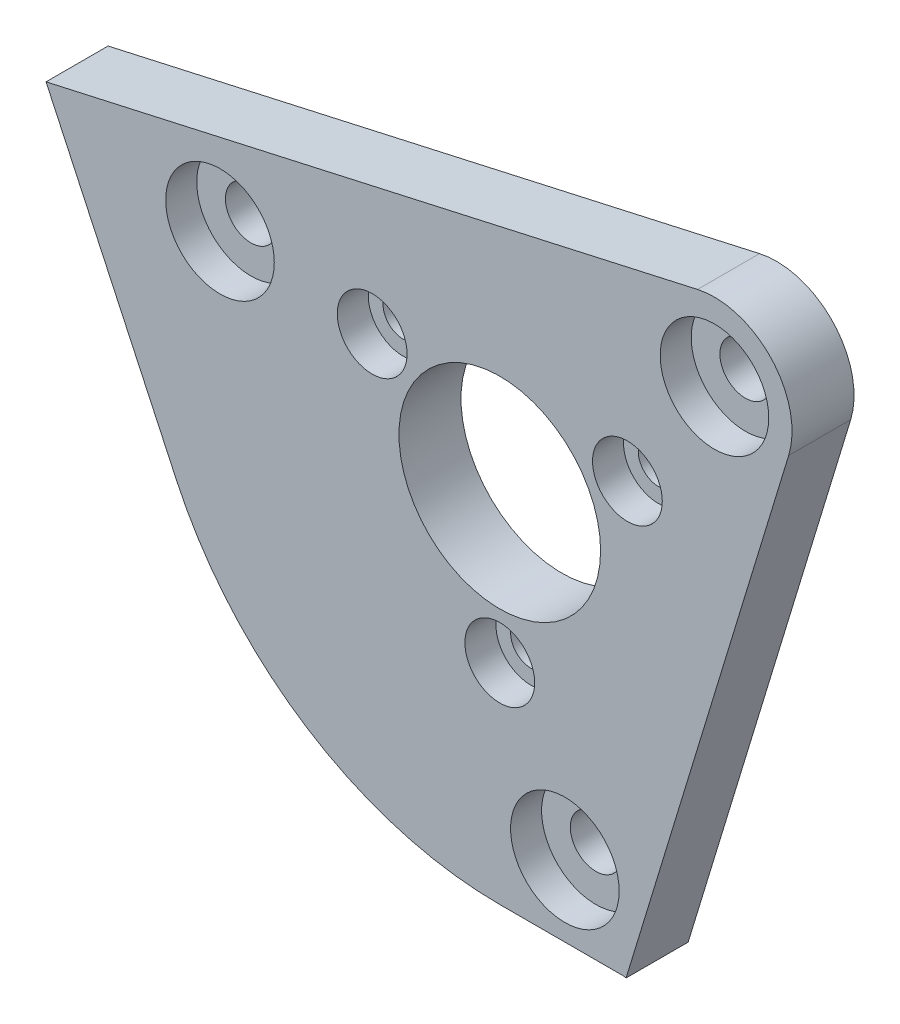
from build123d import *

# Parameters (mm, degrees)
SKETCH_1_R          = 1.3
SKETCH_1_R_2        = 6.5
EXTRUDE_1_DEPTH     = 4
CUT_EXTRUDE_1_DEPTH = 2
CUT_EXTRUDE_2_DEPTH = 10
EXTRUDE_START       = -4
EXTRUDE_2_DEPTH     = 4
FILLET_1_R          = 5
SKETCH_5_R          = 1.65
CUT_EXTRUDE_3_DEPTH = 10
SKETCH_6_R          = 3.5
SKETCH_6_R_2        = 2.25
CUT_EXTRUDE_4_DEPTH = 2


with BuildPart() as part:
    # 草图1 → 凸台-拉伸1 (new body)
    with BuildSketch(Plane.XY):
        with BuildLine():
            Line((8.553461717, -18.071837398), (16.553461717, -18.071837398))
            Line((16.553461717, -18.071837398), (22.424329469, 1.203351624))
            ThreePointArc((22.424329469, 1.203351624), (19.185042818, 15.288156683), (5.383718421, 19.577463907))
            Line((5.383718421, 19.577463907), (-21.197136513, 13.622789192))
            Line((-21.197136513, 13.622789192), (-12.744771278, -4.503366549))
            ThreePointArc((-12.744771278, -4.503366549), (-4.073079079, -14.391536375), (8.553461717, -18.071837398))
        make_face()
        with Locations((16.780703053, 10.178162602)):
            Circle(SKETCH_1_R, mode=Mode.SUBTRACT)
        with Locations((8.553461717, -4.071837398)):
            Circle(SKETCH_1_R, mode=Mode.SUBTRACT)
        with Locations((8.553461717, 5.428162602)):
            Circle(SKETCH_1_R_2, mode=Mode.SUBTRACT)
        with Locations((0.326220381, 10.178162602)):
            Circle(SKETCH_1_R, mode=Mode.SUBTRACT)
    extrude(amount=EXTRUDE_1_DEPTH)

    # 草图2 → 切除-拉伸1 (cut)
    with BuildSketch(Plane.XY.offset(4)):
        with BuildLine():
            Line((-20.74398262, 13.834098323), (-26.791770356, 13.834098323))
            Line((-26.791770356, 13.834098323), (-7.810487919, -16.678792008))
            Line((-7.810487919, -16.678792008), (17.290442954, -20.516537637))
            Line((17.290442954, -20.516537637), (21.405478984, -18.597664823))
            Line((21.405478984, -18.597664823), (16.553461717, -17.571837398))
            Line((16.553461717, -17.571837398), (8.553461717, -17.571837398))
            ThreePointArc((8.553461717, -17.571837398), (-3.804429275, -13.969840652), (-12.291617385, -4.292057418))
            Line((-12.291617385, -4.292057418), (-20.74398262, 13.834098323))
        make_face()
    extrude(amount=-CUT_EXTRUDE_1_DEPTH, mode=Mode.SUBTRACT)

    # 草图3 → 切除-拉伸2 (cut)
    with BuildSketch(Plane.XY.offset(4)):
        with BuildLine():
            Line((16.553461717, -18.071837398), (16.696538979, -17.602087204))
            Line((16.696538979, -17.602087204), (16.553461717, -17.571837398))
            Line((16.553461717, -17.571837398), (8.553461717, -17.571837398))
            ThreePointArc((8.553461717, -17.571837398), (-3.804429275, -13.969840652), (-12.291617385, -4.292057418))
            Line((-12.291617385, -4.292057418), (-20.697627647, 13.734689762))
            Line((-20.697627647, 13.734689762), (-21.197136513, 13.622789192))
            Line((-21.197136513, 13.622789192), (-12.744771278, -4.503366549))
            ThreePointArc((-12.744771278, -4.503366549), (-4.073079079, -14.391536375), (8.553461717, -18.071837398))
            Line((8.553461717, -18.071837398), (16.553461717, -18.071837398))
        make_face()
    extrude(amount=-CUT_EXTRUDE_2_DEPTH, mode=Mode.SUBTRACT)

    # 草图4 → 凸台-拉伸2 (add)
    with BuildSketch(Plane.XY.offset(4).offset(EXTRUDE_START)):
        with BuildLine():
            Line((5.383718421, 19.577463907), (29.678441091, 25.019996556))
            Line((29.678441091, 25.019996556), (22.424329469, 1.203351624))
            ThreePointArc((22.424329469, 1.203351624), (19.185042818, 15.288156683), (5.383718421, 19.577463907))
        make_face()
    extrude(amount=EXTRUDE_2_DEPTH)

    # 圆角1
    fillet_1_edges = [part.edges().sort_by_distance(p)[0] for p in [
        (29.678441091, 25.019996556, 2),
    ]]
    fillet(fillet_1_edges, radius=FILLET_1_R)

    # 草图5 → 切除-拉伸3 (cut)
    with BuildSketch(Plane.XY.offset(4)):
        with Locations((22.393965445, 18.264191744)):
            Circle(SKETCH_5_R)
        with Locations((-9.483117468, 10.99637586)):
            Circle(SKETCH_5_R)
        with Locations((12.749537174, -12.976079799)):
            Circle(SKETCH_5_R)
    extrude(amount=-CUT_EXTRUDE_3_DEPTH, mode=Mode.SUBTRACT)

    # 草图6 → 切除-拉伸4 (cut)
    with BuildSketch(Plane.XY.offset(4)):
        with Locations((22.393965445, 18.264191744)):
            Circle(SKETCH_6_R)
        with Locations((-9.483117468, 10.99637586)):
            Circle(SKETCH_6_R)
        with Locations((12.749537174, -12.976079799)):
            Circle(SKETCH_6_R)
        with Locations((8.553461717, -4.071837398)):
            Circle(SKETCH_6_R_2)
        with Locations((16.780703053, 10.178162602)):
            Circle(SKETCH_6_R_2)
        with Locations((0.326220381, 10.178162602)):
            Circle(SKETCH_6_R_2)
    extrude(amount=-CUT_EXTRUDE_4_DEPTH, mode=Mode.SUBTRACT)


solid = part.part
